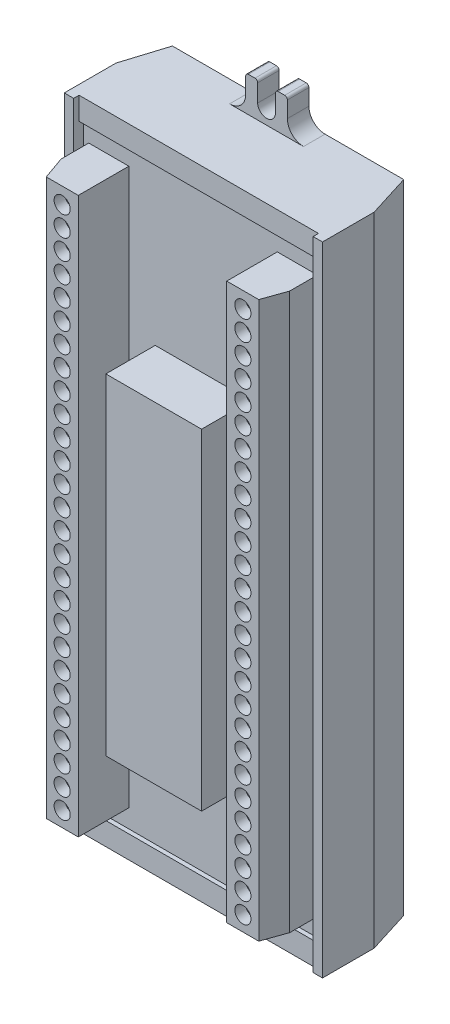
from build123d import *

# Parameters (mm, degrees)
SKETCH1_W           = 48
SKETCH1_H           = 17.6
BOSS_EXTRUDE1_DEPTH = 118.5
SKETCH2_W           = 44.5
SKETCH2_H           = 1
CUT_EXTRUDE1_DEPTH  = 122.225781086
SKETCH3_W           = 44.5
SKETCH3_H           = 110.1
CUT_EXTRUDE2_DEPTH  = 0.8
SKETCH4_W           = 7.75
SKETCH4_H           = 6.5
BOSS_EXTRUDE2_DEPTH = 4
FILLET1_R           = 3
CUT_EXTRUDE3_DEPTH  = 129.494202204
FILLET2_R           = 0.5
SKETCH6_W           = 7.45
SKETCH6_H           = 103.3
BOSS_EXTRUDE3_DEPTH = 9.4
CUT_EXTRUDE4_DEPTH  = 121.945111518
SKETCH8_R           = 1.5
CUT_EXTRUDE5_DEPTH  = 2
SKETCH9_W           = 17.8
SKETCH9_H           = 61.5
BOSS_EXTRUDE4_DEPTH = 9.18


with BuildPart() as part:
    # Sketch1 → Boss-Extrude1 (new body)
    with BuildSketch(Plane(origin=(0, 0, 0), x_dir=(1, 0, 0), z_dir=(0, 1, 0))):
        Rectangle(SKETCH1_W, SKETCH1_H)
    extrude(amount=BOSS_EXTRUDE1_DEPTH)

    # Sketch2 → Cut-Extrude1 (cut, through all)
    with BuildSketch(Plane.XZ):
        with Locations((0, 8.3)):
            Rectangle(SKETCH2_W, SKETCH2_H)
        Polygon((-24, -0.8), (-21.5, -8.8), (-24, -8.8), align=None)
        Polygon((24, -8.8), (21.5, -8.8), (24, -0.8), align=None)
    extrude(amount=-CUT_EXTRUDE1_DEPTH, mode=Mode.SUBTRACT)

    # Sketch3 → Cut-Extrude2 (cut)
    with BuildSketch(Plane.XY.offset(7.8)):
        with Locations((0, 59.25)):
            Rectangle(SKETCH3_W, SKETCH3_H)
    extrude(amount=-CUT_EXTRUDE2_DEPTH, mode=Mode.SUBTRACT)

    # Sketch4 → Boss-Extrude2 (add)
    with BuildSketch(Plane(origin=(0, 0, -8.8), x_dir=(-1, 0, 0), z_dir=(0, 0, -1))):
        with Locations((0, 121.75)):
            Rectangle(SKETCH4_W, SKETCH4_H)
        with Locations((0, -3.25)):
            Rectangle(SKETCH4_W, SKETCH4_H)
    extrude(amount=-BOSS_EXTRUDE2_DEPTH)

    # Fillet1
    fillet1_edges = [part.edges().sort_by_distance(p)[0] for p in [
        (-3.875, 118.5, -6.8),
        (3.875, 118.5, -6.8),
        (3.875, 0, -6.8),
        (-3.875, 0, -6.8),
    ]]
    fillet(fillet1_edges, radius=FILLET1_R)

    # Sketch5 → Cut-Extrude3 (cut, through all)
    with BuildSketch(Plane(origin=(0, 0, -8.8), x_dir=(-1, 0, 0), z_dir=(0, 0, -1))):
        with BuildLine():
            Line((1.65, 129.806526387), (1.65, 121.25))
            ThreePointArc((1.65, 121.25), (0, 119.6), (-1.65, 121.25))
            Line((-1.65, 121.25), (-1.65, 129.806526387))
            ThreePointArc((-1.65, 129.806526387), (0, 131.456526387), (1.65, 129.806526387))
        make_face()
        with BuildLine():
            Line((1.65, -2.75), (1.65, -10.353047519))
            ThreePointArc((1.65, -10.353047519), (0, -12.003047519), (-1.65, -10.353047519))
            Line((-1.65, -10.353047519), (-1.65, -2.75))
            ThreePointArc((-1.65, -2.75), (0, -1.1), (1.65, -2.75))
        make_face()
    extrude(amount=-CUT_EXTRUDE3_DEPTH, mode=Mode.SUBTRACT)

    # Fillet2
    fillet2_edges = [part.edges().sort_by_distance(p)[0] for p in [
        (-1.65, 125, -6.8),
        (1.65, 125, -6.8),
        (-1.65, -6.5, -6.8),
        (1.65, -6.5, -6.8),
        (-3.875, 125, -6.8),
        (3.875, 125, -6.8),
        (3.875, -6.5, -6.8),
        (-3.875, -6.5, -6.8),
    ]]
    fillet(fillet2_edges, radius=FILLET2_R)

    # Sketch6 → Boss-Extrude3 (add)
    with BuildSketch(Plane.XY.offset(7)):
        with Locations((-17.525, 59.25)):
            Rectangle(SKETCH6_W, SKETCH6_H)
        with Locations((17.525, 59.25)):
            Rectangle(SKETCH6_W, SKETCH6_H)
    extrude(amount=BOSS_EXTRUDE3_DEPTH)

    # Sketch7 → Cut-Extrude4 (cut, through all)
    with BuildSketch(Plane.XZ.offset(-7.6)):
        Polygon((-19.75, 16.4), (-21.25, 12.15), (-21.25, 16.4), align=None)
        Polygon((21.25, 16.4), (19.75, 16.4), (21.25, 12.15), align=None)
    extrude(amount=-CUT_EXTRUDE4_DEPTH, mode=Mode.SUBTRACT)

    # Sketch8 → Cut-Extrude5 (cut)
    with BuildSketch(Plane.XY.offset(16.4)):
        with Locations((-16.8, 107.9)):
            Circle(SKETCH8_R)
        with Locations((-16.8, 104.15)):
            Circle(SKETCH8_R)
        with Locations((-16.8, 100.4)):
            Circle(SKETCH8_R)
        with Locations((-16.8, 96.65)):
            Circle(SKETCH8_R)
        with Locations((-16.8, 92.9)):
            Circle(SKETCH8_R)
        with Locations((-16.8, 89.15)):
            Circle(SKETCH8_R)
        with Locations((-16.8, 85.4)):
            Circle(SKETCH8_R)
        with Locations((-16.8, 81.65)):
            Circle(SKETCH8_R)
        with Locations((-16.8, 77.9)):
            Circle(SKETCH8_R)
        with Locations((-16.8, 74.15)):
            Circle(SKETCH8_R)
        with Locations((-16.8, 70.4)):
            Circle(SKETCH8_R)
        with Locations((-16.8, 66.65)):
            Circle(SKETCH8_R)
        with Locations((-16.8, 62.9)):
            Circle(SKETCH8_R)
        with Locations((-16.8, 59.15)):
            Circle(SKETCH8_R)
        with Locations((-16.8, 55.4)):
            Circle(SKETCH8_R)
        with Locations((-16.8, 51.65)):
            Circle(SKETCH8_R)
        with Locations((-16.8, 47.9)):
            Circle(SKETCH8_R)
        with Locations((-16.8, 44.15)):
            Circle(SKETCH8_R)
        with Locations((-16.8, 40.4)):
            Circle(SKETCH8_R)
        with Locations((-16.8, 36.65)):
            Circle(SKETCH8_R)
        with Locations((-16.8, 32.9)):
            Circle(SKETCH8_R)
        with Locations((-16.8, 29.15)):
            Circle(SKETCH8_R)
        with Locations((-16.8, 25.4)):
            Circle(SKETCH8_R)
        with Locations((-16.8, 21.65)):
            Circle(SKETCH8_R)
        with Locations((-16.8, 17.9)):
            Circle(SKETCH8_R)
        with Locations((-16.8, 14.15)):
            Circle(SKETCH8_R)
        with Locations((-16.8, 10.4)):
            Circle(SKETCH8_R)
        with Locations(Location((16.8, 10.4, 0), (0, 0, 180))):
            Circle(SKETCH8_R)
        with Locations(Location((16.8, 14.15, 0), (0, 0, 180))):
            Circle(SKETCH8_R)
        with Locations(Location((16.8, 17.9, 0), (0, 0, 180))):
            Circle(SKETCH8_R)
        with Locations(Location((16.8, 21.65, 0), (0, 0, 180))):
            Circle(SKETCH8_R)
        with Locations(Location((16.8, 25.4, 0), (0, 0, 180))):
            Circle(SKETCH8_R)
        with Locations(Location((16.8, 29.15, 0), (0, 0, 180))):
            Circle(SKETCH8_R)
        with Locations(Location((16.8, 32.9, 0), (0, 0, 180))):
            Circle(SKETCH8_R)
        with Locations(Location((16.8, 36.65, 0), (0, 0, 180))):
            Circle(SKETCH8_R)
        with Locations(Location((16.8, 40.4, 0), (0, 0, 180))):
            Circle(SKETCH8_R)
        with Locations(Location((16.8, 44.15, 0), (0, 0, 180))):
            Circle(SKETCH8_R)
        with Locations(Location((16.8, 47.9, 0), (0, 0, 180))):
            Circle(SKETCH8_R)
        with Locations(Location((16.8, 51.65, 0), (0, 0, 180))):
            Circle(SKETCH8_R)
        with Locations(Location((16.8, 55.4, 0), (0, 0, 180))):
            Circle(SKETCH8_R)
        with Locations(Location((16.8, 59.15, 0), (0, 0, 180))):
            Circle(SKETCH8_R)
        with Locations(Location((16.8, 62.9, 0), (0, 0, 180))):
            Circle(SKETCH8_R)
        with Locations(Location((16.8, 66.65, 0), (0, 0, 180))):
            Circle(SKETCH8_R)
        with Locations(Location((16.8, 70.4, 0), (0, 0, 180))):
            Circle(SKETCH8_R)
        with Locations(Location((16.8, 74.15, 0), (0, 0, 180))):
            Circle(SKETCH8_R)
        with Locations(Location((16.8, 77.9, 0), (0, 0, 180))):
            Circle(SKETCH8_R)
        with Locations(Location((16.8, 81.65, 0), (0, 0, 180))):
            Circle(SKETCH8_R)
        with Locations(Location((16.8, 85.4, 0), (0, 0, 180))):
            Circle(SKETCH8_R)
        with Locations(Location((16.8, 89.15, 0), (0, 0, 180))):
            Circle(SKETCH8_R)
        with Locations(Location((16.8, 92.9, 0), (0, 0, 180))):
            Circle(SKETCH8_R)
        with Locations(Location((16.8, 96.65, 0), (0, 0, 180))):
            Circle(SKETCH8_R)
        with Locations(Location((16.8, 100.4, 0), (0, 0, 180))):
            Circle(SKETCH8_R)
        with Locations(Location((16.8, 104.15, 0), (0, 0, 180))):
            Circle(SKETCH8_R)
        with Locations(Location((16.8, 107.9, 0), (0, 0, 180))):
            Circle(SKETCH8_R)
    extrude(amount=-CUT_EXTRUDE5_DEPTH, mode=Mode.SUBTRACT)

    # Sketch9 → Boss-Extrude4 (add)
    with BuildSketch(Plane.XY.offset(7)):
        with Locations((0.001215362, 53.75)):
            Rectangle(SKETCH9_W, SKETCH9_H)
    extrude(amount=BOSS_EXTRUDE4_DEPTH)


solid = part.part
